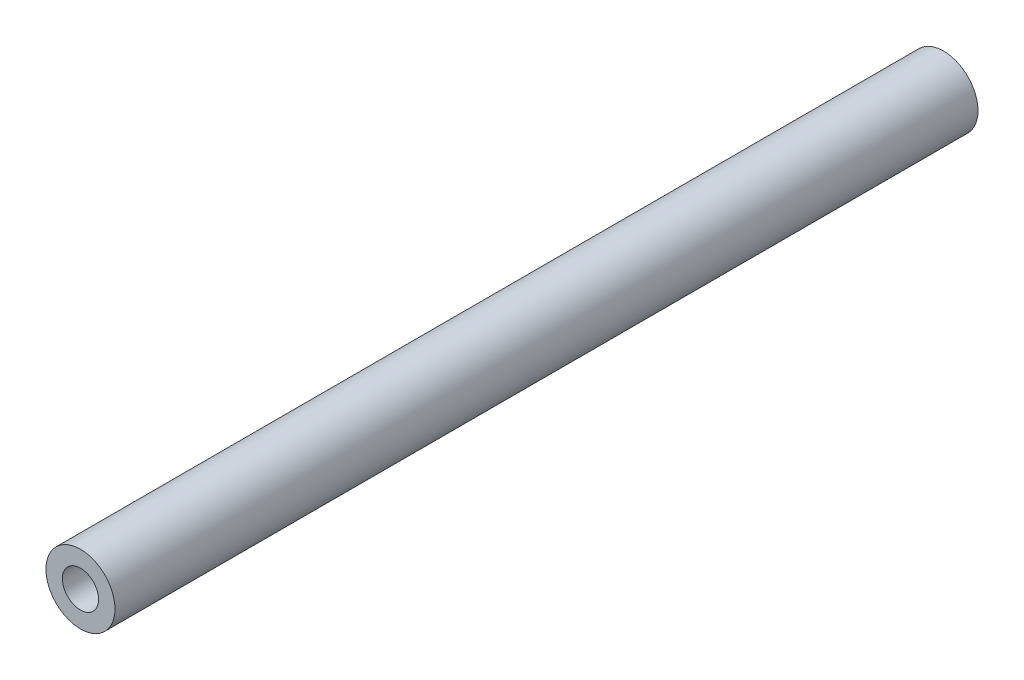
from build123d import *

# Parameters (mm, degrees)
SKETCH_1_R      = 4
EXTRUDE_1_DEPTH = 50


with BuildPart() as part:
    # 草图1 → 凸台-拉伸1 (new, symmetric)
    with BuildSketch(Plane.XY):
        Circle(SKETCH_1_R)
    extrude(amount=EXTRUDE_1_DEPTH, both=True)

    # 草图3 → M5 螺纹孔1 (revolve, cut)
    with BuildSketch(Plane(origin=(0, 0, 50), x_dir=(0, -1, 0), z_dir=(1, 0, 0))):
        Polygon((0, 0), (0, 13.6618073), (2.1, 12.4), (2.1, 0), align=None)
    hole_wizard_m5_1 = revolve(axis=Axis((0, 0, 56.35), (0, 0, -1)), mode=Mode.SUBTRACT)

    # 镜向1: M5 螺纹孔1 across plane
    add(hole_wizard_m5_1.mirror(Plane.XY), mode=Mode.SUBTRACT)


solid = part.part
